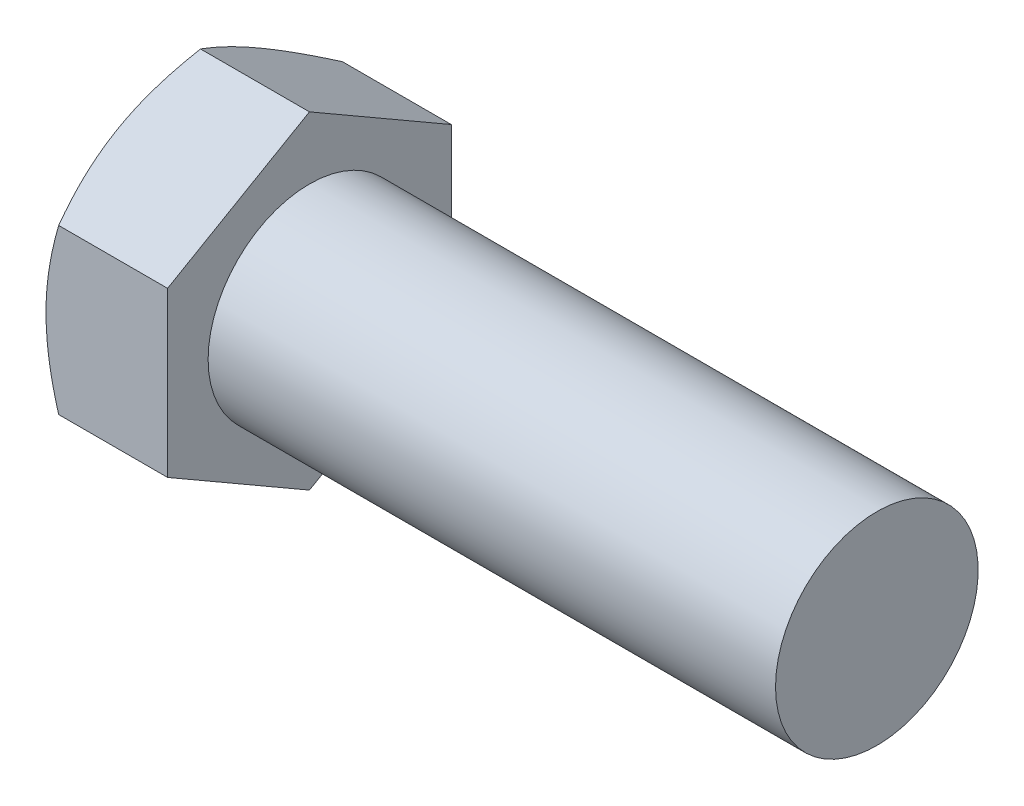
from build123d import *

# Parameters (mm, degrees)
BASEHEAD_DEPTH = 6
BODYSKE_W      = 34
BODYSKE_H      = 5


with BuildPart() as part:
    # Sketch1 → BaseHead (new body)
    with BuildSketch(Plane(origin=(0, 0, 0), x_dir=(0, 0, -1), z_dir=(1, 0, 0))):
        Polygon((7, 4.041451884), (7, -4.041451884), (0, -8.082903769), (-7, -4.041451884), (-7, 4.041451884), (0, 8.082903769), align=None)
    extrude(amount=BASEHEAD_DEPTH)

    # BodySke → BaseBody (revolve)
    with BuildSketch(Plane.XY, mode=Mode.PRIVATE) as basebody_sk:
        with Locations((17, 2.5)):
            Rectangle(BODYSKE_W, BODYSKE_H)
    revolve(basebody_sk.sketch.rotate(Axis((0, 0, 0), (1, 0, 0)), 90), axis=Axis((0, 0, 0), (1, 0, 0)))

    # Sketch3 → HeadChamfer (revolve, cut)
    with BuildSketch(Plane.XY):
        Polygon((0, 7), (3.511966128, 13.082903769), (3.511966128, 18.082903769), (-10, 18.082903769), (-10, 7), align=None)
    revolve(axis=Axis((0, 0, 0), (1, 0, 0)), mode=Mode.SUBTRACT)


solid = part.part
